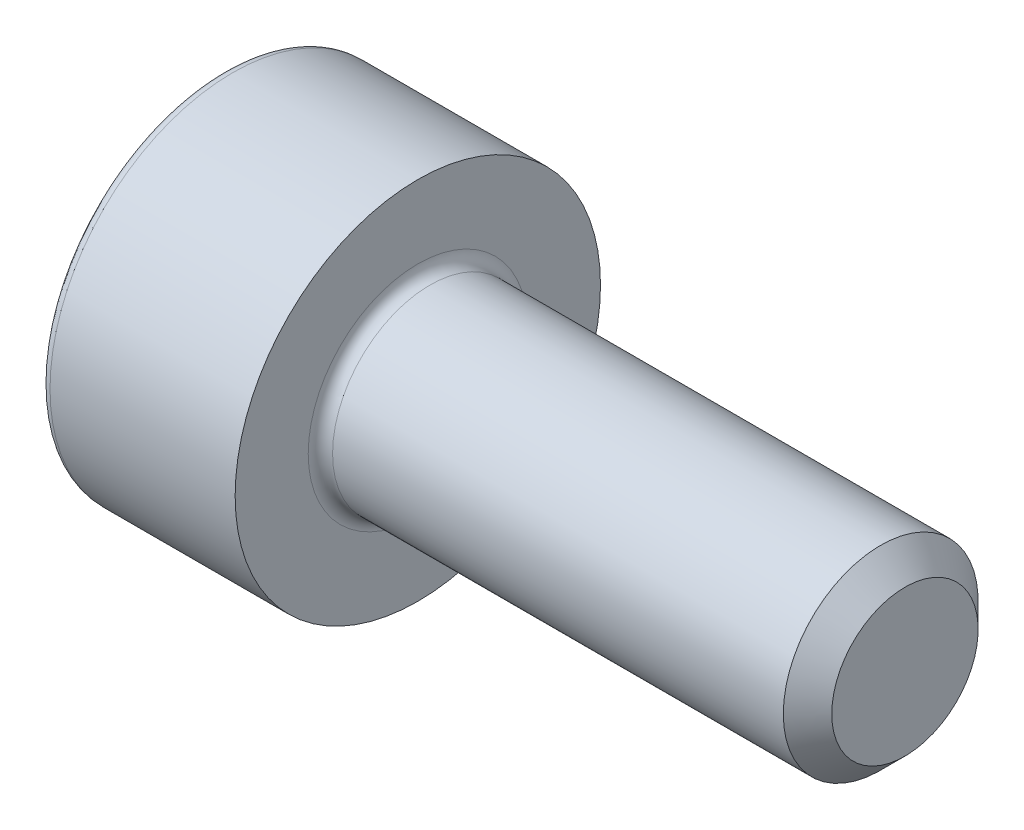
from build123d import *

# Parameters (mm, degrees)
FILLET1_R   = 0.1
FILLET2_R   = 0.08
HEX_2_DEPTH = 0.7


with BuildPart() as part:
    # BodySke → BaseBody (revolve)
    with BuildSketch(Plane.XY, mode=Mode.PRIVATE) as basebody_sk:
        Polygon((0, 0), (0, 1.5), (1.6, 1.5), (1.6, 0.8), (5.401, 0.8), (5.6, 0.601), (5.6, 0), align=None)
    revolve(basebody_sk.sketch.rotate(Axis((0, 0, 0), (1, 0, 0)), 90), axis=Axis((0, 0, 0), (1, 0, 0)))

    # Fillet1
    fillet1_edges = [part.edges().sort_by_distance(p)[0] for p in [
        (1.6, 0, -0.8),
    ]]
    fillet(fillet1_edges, radius=FILLET1_R)

    # Fillet2
    fillet2_edges = [part.edges().sort_by_distance(p)[0] for p in [
        (0, 0, -1.5),
    ]]
    fillet(fillet2_edges, radius=FILLET2_R)

    # HexSke → Hex 2 (cut)
    with BuildSketch(Plane(origin=(0, 0, 0), x_dir=(0, 0, -1), z_dir=(1, 0, 0))):
        Polygon((0, 0.866025404), (-0.75, 0.433012702), (-0.75, -0.433012702), (0, -0.866025404), (0.75, -0.433012702), (0.75, 0.433012702), align=None)
    extrude(amount=HEX_2_DEPTH, mode=Mode.SUBTRACT)

    # Hex-PreBroachSke → Hex-PreBroach (revolve, cut)
    with BuildSketch(Plane.XY, mode=Mode.PRIVATE) as hex_prebroach_sk:
        Polygon((0, 0), (0, 0.75), (0.7, 0.75), (1.133012702, 0), align=None)
    revolve(hex_prebroach_sk.sketch.rotate(Axis((0, 0, 0), (1, 0, 0)), 270), axis=Axis((0, 0, 0), (1, 0, 0)), mode=Mode.SUBTRACT)


solid = part.part
